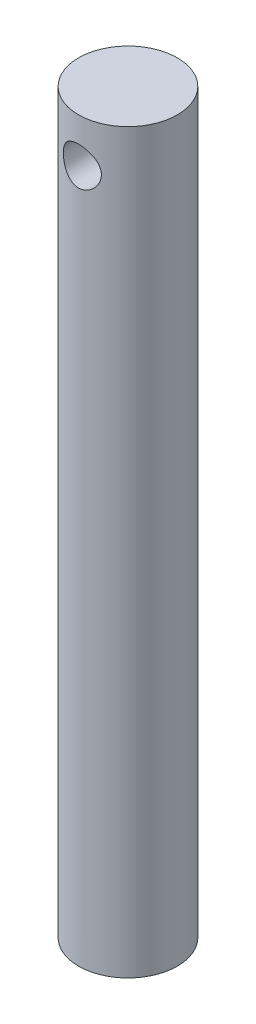
from build123d import *

# Parameters (mm, degrees)
SKETCH1_R               = 9.906
BOSS_EXTRUDE1_DEPTH     = 127
SKETCH2_R               = 9.906
BOSS_EXTRUDE2_DEPTH     = 20.828
CUT_EXTRUDE1_DEPTH      = 15.748
CUT_EXTRUDE1_DEPTH_BACK = 15.748
SKETCH3_R               = 3.81


with BuildPart() as part:
    # Sketch1 → Boss-Extrude1 (new body)
    with BuildSketch(Plane(origin=(0, 0, 0), x_dir=(1, 0, 0), z_dir=(0, 1, 0))):
        with Locations(Location((0, 0, 0), (0, 0, 270))):
            Circle(SKETCH1_R)
    extrude(amount=BOSS_EXTRUDE1_DEPTH)

    # Sketch2 → Boss-Extrude2 (add)
    with BuildSketch(Plane(origin=(0, 127, 0), x_dir=(1, 0, 0), z_dir=(0, 1, 0))):
        with Locations(Location((0, 0, 0), (0, 0, 270))):
            Circle(SKETCH2_R)
    extrude(amount=BOSS_EXTRUDE2_DEPTH)

    # Sketch3 → Cut-Extrude1 (cut, two sides: drawn at the far end of the back side and taken through both)
    with BuildSketch(Plane.XY.offset(-CUT_EXTRUDE1_DEPTH_BACK)):
        with Locations(Location((0, 138.938, 0), (0, 0, 90.000000001))):
            Circle(SKETCH3_R)
    extrude(amount=CUT_EXTRUDE1_DEPTH + CUT_EXTRUDE1_DEPTH_BACK, mode=Mode.SUBTRACT)


solid = part.part
